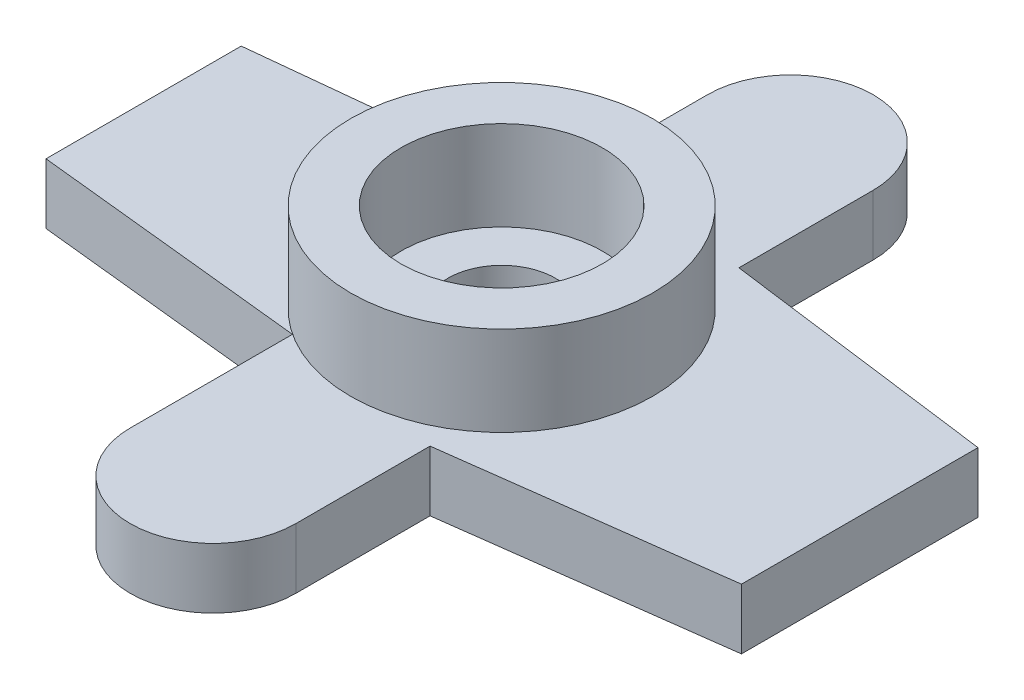
from build123d import *

# Parameters (mm, degrees)
ESTRUSIONE_ESTRUSIONE1_DEPTH = 1.35
SCHIZZO2_R                   = 3.375
ESTRUSIONE_ESTRUSIONE2_DEPTH = 2
SCHIZZO3_R                   = 2.25
TAGLIO_ESTRUSIONE1_DEPTH     = 2
SCHIZZO4_R                   = 1.2
TAGLIO_ESTRUSIONE2_DEPTH     = 12.7


with BuildPart() as part:
    # Schizzo1 → Estrusione-Estrusione1 (new body)
    with BuildSketch(Plane(origin=(0, 0, 0), x_dir=(1, 0, 0), z_dir=(0, 1, 0))):
        with BuildLine():
            ThreePointArc((1.85, 6.45), (0, 8.3), (-1.85, 6.45))
            Line((-1.85, 6.45), (-1.85, 2.824645909))
            Line((-1.85, 2.824645909), (-8, 2.180648096))
            Line((-8, 2.180648096), (-8, -2.180648096))
            Line((-8, -2.180648096), (-1.85, -2.824645909))
            Line((-1.85, -2.824645909), (-1.85, -6.45))
            ThreePointArc((-1.85, -6.45), (0, -8.3), (1.85, -6.45))
            Line((1.85, -6.45), (1.85, -3.45))
            Line((1.85, -3.45), (8, -2.642424242))
            Line((8, -2.642424242), (8, 2.642424242))
            Line((8, 2.642424242), (1.85, 3.45))
            Line((1.85, 3.45), (1.85, 6.45))
        make_face()
    extrude(amount=ESTRUSIONE_ESTRUSIONE1_DEPTH)

    # Schizzo2 → Estrusione-Estrusione2 (add)
    with BuildSketch(Plane(origin=(0, 1.35, 0), x_dir=(1, 0, 0), z_dir=(0, 1, 0))):
        with Locations(Location((0, 0, 0), (0, 0, 270))):
            Circle(SCHIZZO2_R)
    extrude(amount=ESTRUSIONE_ESTRUSIONE2_DEPTH)

    # Schizzo3 → Taglio-Estrusione1 (cut)
    with BuildSketch(Plane(origin=(0, 3.35, 0), x_dir=(1, 0, 0), z_dir=(0, 1, 0))):
        with Locations(Location((0, 0, 0), (0, 0, 270))):
            Circle(SCHIZZO3_R)
    extrude(amount=-TAGLIO_ESTRUSIONE1_DEPTH, mode=Mode.SUBTRACT)

    # Schizzo4 → Taglio-Estrusione2 (cut, through all)
    with BuildSketch(Plane(origin=(0, 1.35, 0), x_dir=(1, 0, 0), z_dir=(0, 1, 0))):
        with Locations(Location((0, 0, 0), (0, 0, 270))):
            Circle(SCHIZZO4_R)
    extrude(amount=-TAGLIO_ESTRUSIONE2_DEPTH, mode=Mode.SUBTRACT)


solid = part.part
